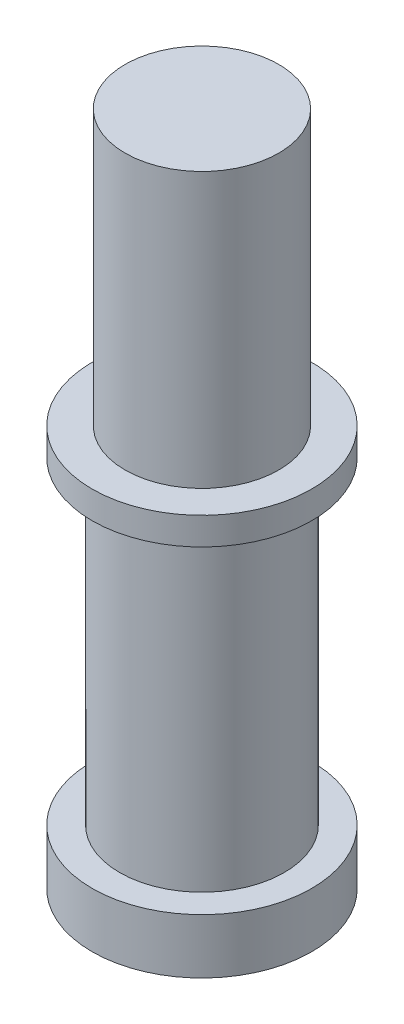
from build123d import *

# Parameters (mm, degrees)
SKETCH2_R           = 2
BOSS_EXTRUDE1_DEPTH = 1
SKETCH3_R           = 1.5
BOSS_EXTRUDE2_DEPTH = 5.8
SKETCH4_R           = 2
BOSS_EXTRUDE3_DEPTH = 0.5
SKETCH5_R           = 1.4
BOSS_EXTRUDE4_DEPTH = 5


with BuildPart() as part:
    # Sketch2 → Boss-Extrude1 (new body)
    with BuildSketch(Plane(origin=(0, 0, 0), x_dir=(1, 0, 0), z_dir=(0, 1, 0))):
        with Locations(Location((0, 0, 0), (0, 0, 270))):
            Circle(SKETCH2_R)
    extrude(amount=BOSS_EXTRUDE1_DEPTH)

    # Sketch3 → Boss-Extrude2 (add)
    with BuildSketch(Plane(origin=(0, 1, 0), x_dir=(1, 0, 0), z_dir=(0, 1, 0))):
        with Locations(Location((0, 0, 0), (0, 0, 270))):
            Circle(SKETCH3_R)
    extrude(amount=BOSS_EXTRUDE2_DEPTH)

    # Sketch4 → Boss-Extrude3 (add)
    with BuildSketch(Plane(origin=(0, 6.8, 0), x_dir=(1, 0, 0), z_dir=(0, 1, 0))):
        with Locations(Location((0, 0, 0), (0, 0, 270))):
            Circle(SKETCH4_R)
    extrude(amount=BOSS_EXTRUDE3_DEPTH)

    # Sketch5 → Boss-Extrude4 (add)
    with BuildSketch(Plane(origin=(0, 7.3, 0), x_dir=(1, 0, 0), z_dir=(0, 1, 0))):
        with Locations(Location((0, 0, 0), (0, 0, 270))):
            Circle(SKETCH5_R)
    extrude(amount=BOSS_EXTRUDE4_DEPTH)


solid = part.part
